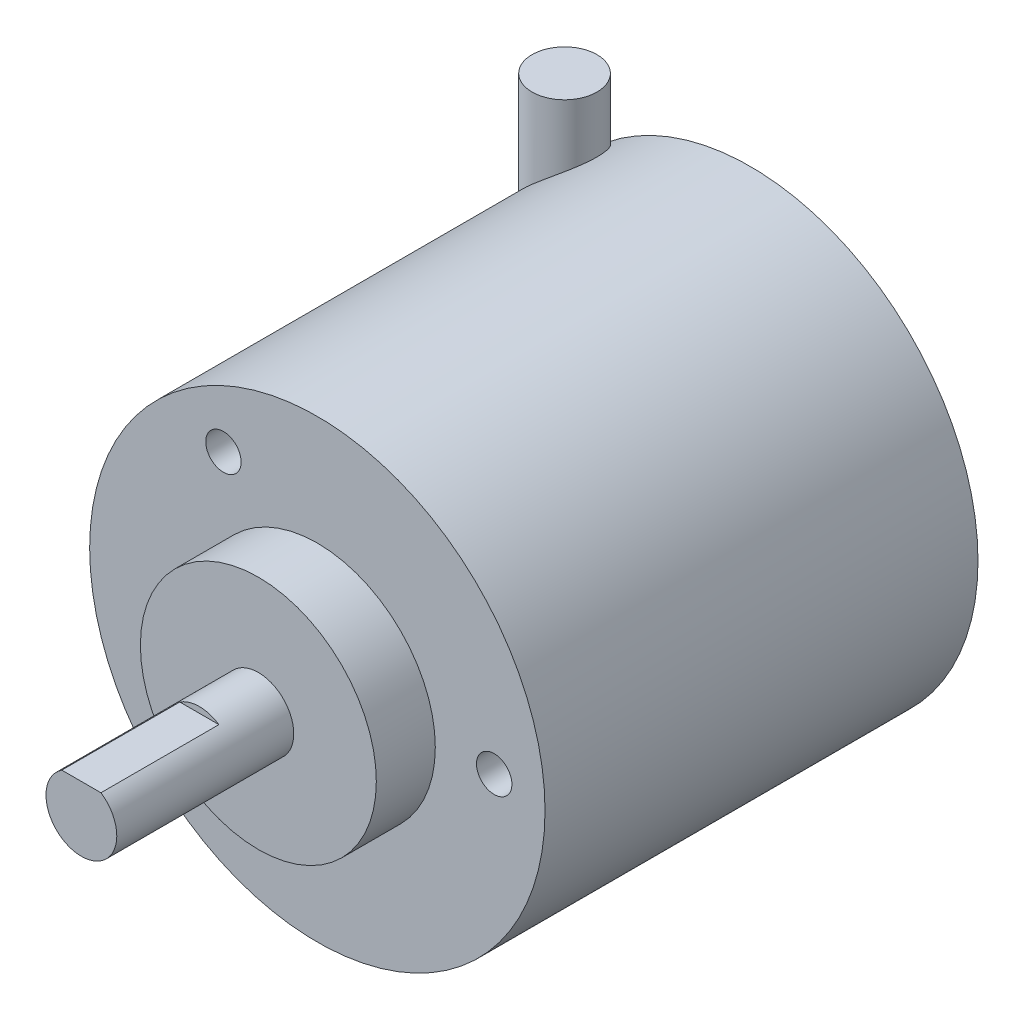
from build123d import *
from build123d.topology import SkipClean

# Parameters (mm, degrees)
SKETCH1_R           = 19.3
BOSS_EXTRUDE1_DEPTH = 36.7
SKETCH3_R           = 10
BOSS_EXTRUDE2_DEPTH = 5
SKETCH4_R           = 3
BOSS_EXTRUDE3_DEPTH = 15
BOSS_EXTRUDE4_START = -3
SKETCH8_R           = 2.75
BOSS_EXTRUDE4_DEPTH = 15
SKETCH9_R           = 2.75
BOSS_EXTRUDE5_DEPTH = 5
SKETCH5_R           = 1.5
CUT_EXTRUDE1_DEPTH  = 10
CUT_EXTRUDE2_DEPTH  = 10


with BuildPart() as part:
    # Sketch1 → Boss-Extrude1 (new body)
    with BuildSketch(Plane.XY):
        with Locations((-14.127422454, 5.37928778)):
            Circle(SKETCH1_R)
    extrude(amount=BOSS_EXTRUDE1_DEPTH)

    # Sketch3 → Boss-Extrude2 (add)
    with BuildSketch(Plane.XY.offset(36.7)):
        with Locations((-14.127422454, 5.37928778)):
            Circle(SKETCH3_R)
    extrude(amount=BOSS_EXTRUDE2_DEPTH)

    # Sketch4 → Boss-Extrude3 (add)
    with BuildSketch(Plane.XY.offset(41.7)):
        with Locations((-14.127422454, 5.37928778)):
            Circle(SKETCH4_R)
    extrude(amount=BOSS_EXTRUDE3_DEPTH)



with BuildPart() as body_2:
    # Sketch8 → Boss-Extrude4 (new body)
    with BuildSketch(Plane(origin=(0, 24.67928778, 0), x_dir=(1, 0, 0), z_dir=(0, 1, 0)).offset(BOSS_EXTRUDE4_START)):
        with Locations(Location((-26.832117877, -3.04260895, 0), (0, 0, 270))):
            Circle(SKETCH8_R)
    extrude(amount=-BOSS_EXTRUDE4_DEPTH)


with BuildPart() as part_1:
    with SkipClean():  # the faces are left unmerged after this step: merging them gives an invalid solid
        add(part.part)

        add(body_2.part)  # Boss-Extrude5 merges body 2
        # Sketch9 → Boss-Extrude5 (add)
        with BuildSketch(Plane(origin=(0, 21.67928778, 0), x_dir=(1, 0, 0), z_dir=(0, 1, 0))):
            with Locations(Location((-26.832117877, -3.04260895, 0), (0, 0, 329.533131332))):
                Circle(SKETCH9_R)
        extrude(amount=BOSS_EXTRUDE5_DEPTH)

    # Sketch5 → Cut-Extrude1 (cut)
    with SkipClean():  # the faces are left unmerged after this step: merging them gives an invalid solid
        with BuildSketch(Plane.XY.offset(36.7)):
            with Locations((0.862954929, 5.91648973)):
                Circle(SKETCH5_R)
            with Locations((-21.15738061, -7.87136082)):
                Circle(SKETCH5_R)
            with Locations((-22.08784168, 18.092734431)):
                Circle(SKETCH5_R)
        extrude(amount=-CUT_EXTRUDE1_DEPTH, mode=Mode.SUBTRACT)

    # Sketch10 → Cut-Extrude2 (cut)
    with SkipClean():  # the faces are left unmerged after this step: merging them gives an invalid solid
        with BuildSketch(Plane.XY.offset(56.7)):
            Polygon((-86.266834938, 7.87928778), (-15.785734849, 7.87928778), (-12.469110059, 7.87928778), (58.011990031, 7.87928778), (58.011990031, 148.841487959), (-86.266834938, 148.841487959), align=None)
        extrude(amount=-CUT_EXTRUDE2_DEPTH, mode=Mode.SUBTRACT)


solid = part_1.part
